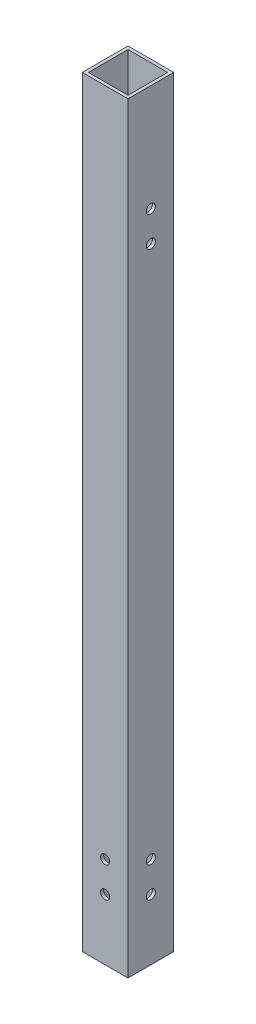
from build123d import *

# Parameters (mm, degrees)
BOSS_EXTRUDE1_DEPTH = 500
SKETCH3_W           = 26
SKETCH3_H           = 26
CUT_EXTRUDE1_DEPTH  = 500
SKETCH5_R           = 3
CUT_EXTRUDE2_DEPTH  = 30
SKETCH6_R           = 3
CUT_EXTRUDE3_DEPTH  = 30
SKETCH9_R           = 3
CUT_EXTRUDE6_DEPTH  = 30


with BuildPart() as part:
    # Sketch1 → Boss-Extrude1 (new body)
    with BuildSketch(Plane(origin=(0, 0, 0), x_dir=(1, 0, 0), z_dir=(0, 1, 0))):
        Polygon((-15, 0), (-15, 15), (15, 15), (15, -15), (-15, -15), align=None)
    extrude(amount=BOSS_EXTRUDE1_DEPTH)

    # Sketch3 → Cut-Extrude1 (cut)
    with BuildSketch(Plane(origin=(0, 500, 0), x_dir=(1, 0, 0), z_dir=(0, 1, 0))):
        Rectangle(SKETCH3_W, SKETCH3_H)
    extrude(amount=-CUT_EXTRUDE1_DEPTH, mode=Mode.SUBTRACT)

    # Sketch5 → Cut-Extrude2 (cut)
    with BuildSketch(Plane(origin=(15, 0, 0), x_dir=(0, 0, -1), z_dir=(1, 0, 0))):
        with Locations((0, 60)):
            Circle(SKETCH5_R)
        with Locations((0, 40)):
            Circle(SKETCH5_R)
    extrude(amount=-CUT_EXTRUDE2_DEPTH, mode=Mode.SUBTRACT)

    # Sketch6 → Cut-Extrude3 (cut)
    with BuildSketch(Plane.XY.offset(15)):
        with Locations((0, 40)):
            Circle(SKETCH6_R)
        with Locations((0, 60)):
            Circle(SKETCH6_R)
    extrude(amount=-CUT_EXTRUDE3_DEPTH, mode=Mode.SUBTRACT)

    # Sketch9 → Cut-Extrude6 (cut)
    with BuildSketch(Plane.ZY.offset(15)):
        with Locations((0, 430)):
            Circle(SKETCH9_R)
        with Locations((0, 410)):
            Circle(SKETCH9_R)
    extrude(amount=-CUT_EXTRUDE6_DEPTH, mode=Mode.SUBTRACT)


solid = part.part
